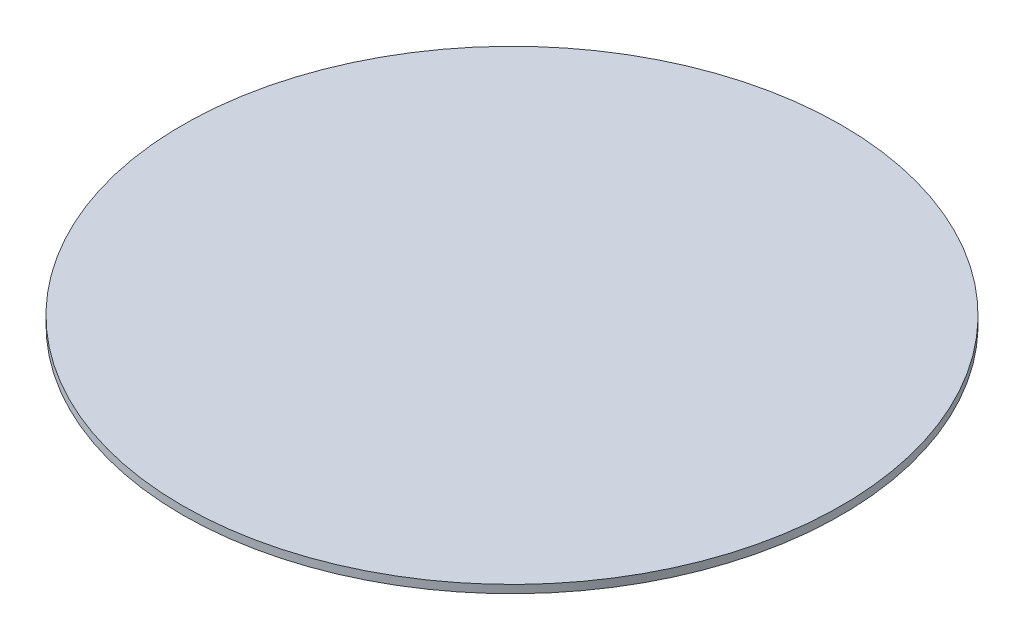
from build123d import *

# Parameters (mm, degrees)
ESQUISSE1_R        = 41
BOSS_EXTRU_1_DEPTH = 1


with BuildPart() as part:
    # Esquisse1 → Boss.-Extru.1 (new body)
    with BuildSketch(Plane(origin=(0, 0, 0), x_dir=(1, 0, 0), z_dir=(0, 1, 0))):
        with Locations(Location((0, 0, 0), (0, 0, 270))):
            Circle(ESQUISSE1_R)
    extrude(amount=BOSS_EXTRU_1_DEPTH)


solid = part.part
